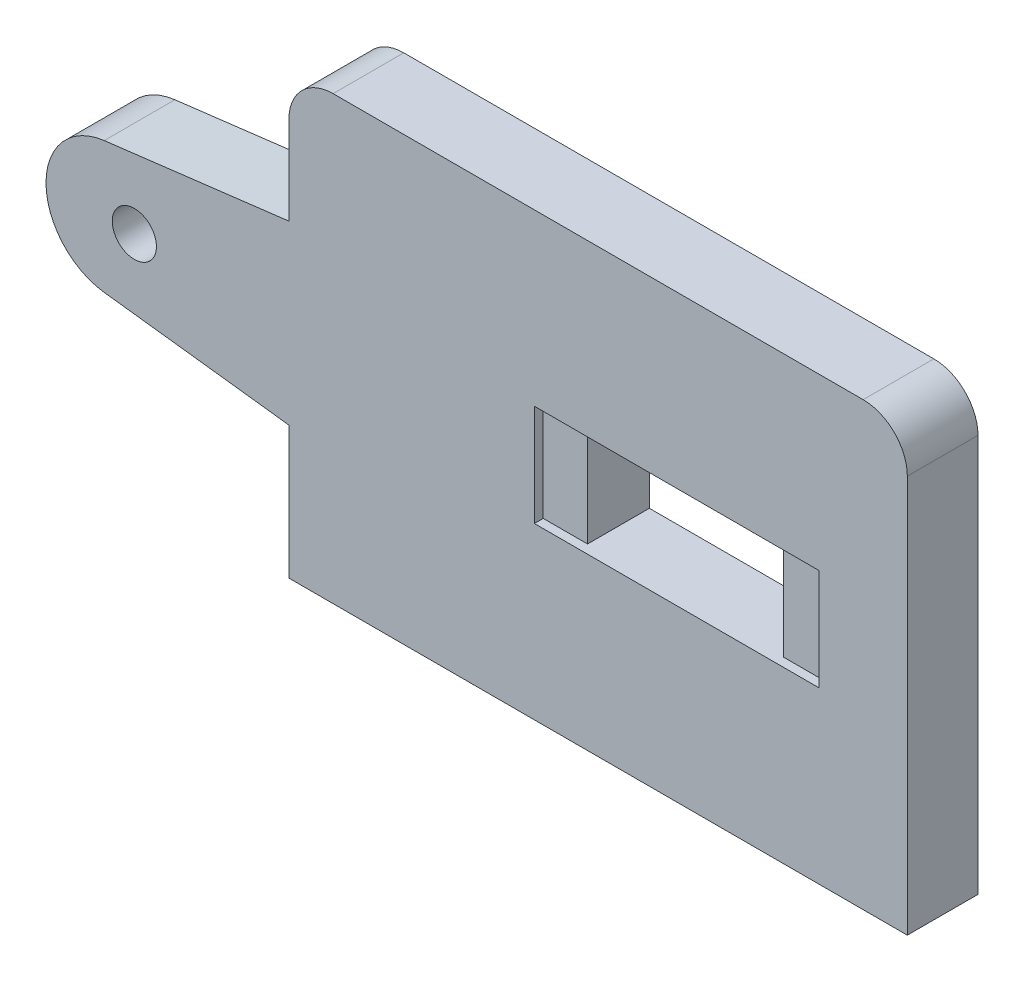
from build123d import *

# Parameters (mm, degrees)
BOSS_EXTRUDE1_DEPTH = 8
SKETCH3_W           = 22.2
SKETCH3_H           = 11.5
CUT_EXTRUDE1_DEPTH  = 8
SKETCH4_R           = 2.5
CUT_EXTRUDE2_DEPTH  = 20
SKETCH6_W           = 5.014738262
SKETCH6_H           = 11.5
CUT_EXTRUDE3_DEPTH  = 1


with BuildPart() as part:
    # Sketch1 → Boss-Extrude1 (new body)
    with BuildSketch(Plane.XY):
        with BuildLine():
            Line((-35, 20), (-35, 10))
            Line((-35, 10), (-55.909806165, 7.44461233))
            ThreePointArc((-55.909806165, 7.44461233), (-50.028760026, 5.615761134), (-47.5, 0))
            ThreePointArc((-47.5, 0), (-50.028760026, -5.615761134), (-55.909806165, -7.44461233))
            Line((-55.909806165, -7.44461233), (-35, -10))
            Line((-35, -10), (-35, -25))
            Line((-35, -25), (35, -25))
            Line((35, -25), (35, 20))
            ThreePointArc((35, 20), (33.535533906, 23.535533906), (30, 25))
            Line((30, 25), (-30, 25))
            ThreePointArc((-30, 25), (-33.535533906, 23.535533906), (-35, 20))
        make_face()
        with BuildLine():
            ThreePointArc((-47.5, 0), (-50.028760026, 5.615761134), (-55.909806165, 7.44461233))
            ThreePointArc((-55.909806165, 7.44461233), (-62.5, 0), (-55.909806165, -7.44461233))
            ThreePointArc((-55.909806165, -7.44461233), (-50.028760026, -5.615761134), (-47.5, 0))
        make_face()
    extrude(amount=BOSS_EXTRUDE1_DEPTH)

    # Sketch3 → Cut-Extrude1 (cut)
    with BuildSketch(Plane.XY.offset(8)):
        with Locations((8.9, 0)):
            Rectangle(SKETCH3_W, SKETCH3_H)
    extrude(amount=-CUT_EXTRUDE1_DEPTH, mode=Mode.SUBTRACT)

    # Sketch4 → Cut-Extrude2 (cut)
    with BuildSketch(Plane.XY.offset(8)):
        with Locations((-52.5, 0)):
            Circle(SKETCH4_R)
    extrude(amount=-CUT_EXTRUDE2_DEPTH, mode=Mode.SUBTRACT)

    # Sketch6 → Cut-Extrude3 (cut)
    with BuildSketch(Plane.XY.offset(8)):
        with Locations((-4.707369131, 0)):
            Rectangle(SKETCH6_W, SKETCH6_H)
        with Locations((22.507369131, 0)):
            Rectangle(SKETCH6_W, SKETCH6_H)
    extrude(amount=-CUT_EXTRUDE3_DEPTH, mode=Mode.SUBTRACT)


solid = part.part
